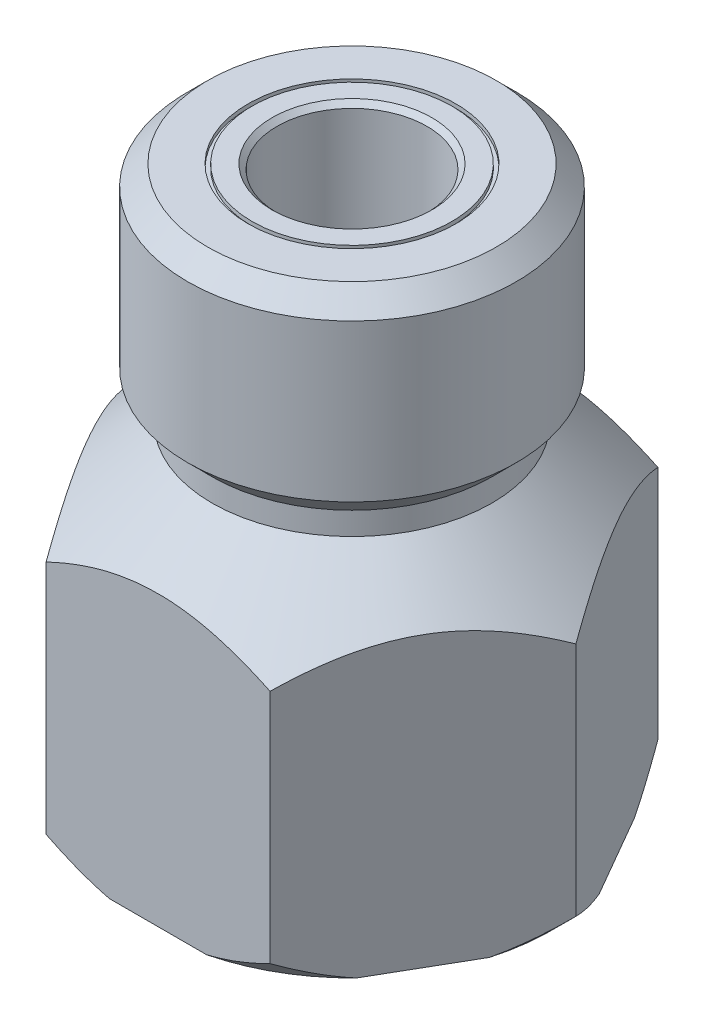
from build123d import *

# Parameters (mm, degrees)
F_3_8_0_375_DIAMETER_HOLE1_D           = 9.525
F_3_8_0_375_DIAMETER_HOLE1_DEPTH       = 13.335
F_3_8_0_375_DIAMETER_HOLE1_CSINK_D     = 10.16
F_3_8_0_375_DIAMETER_HOLE1_CSINK_ANGLE = 90
F_3_8_0_375_DIAMETER_HOLE1_TIP         = 2.861598698
SKETCH4_R                              = 1.27
CUT_EXTRUDE1_DEPTH                     = 29.323277935
CHAMFER1_SIZE                          = 1.524
CUT_EXTRUDE2_DEPTH                     = 42.076598545
CHAMFER2_SIZE                          = 1.27
SKETCH6_R                              = 6.604
SKETCH6_R_2                            = 6.35
CUT_EXTRUDE3_DEPTH                     = 0.254
CHAMFER3_SIZE                          = 0.762


with BuildPart() as part:
    # Sketch1 → Revolve1 (revolve)
    with BuildSketch(Plane.XY, mode=Mode.PRIVATE) as revolve1_sk:
        Polygon((9.525, 0), (14.224, 0), (14.224, 16.51), (8.89, 21.59), (8.89, 23.0378), (10.4394, 24.5872), (10.4394, 35.814), (0, 35.814), (0, 14.097), (1.27, 14.097), (1.27, 15.875), (9.525, 15.875), align=None)
    revolve(revolve1_sk.sketch.rotate(Axis((0, 1.826937735, 0), (0, 1, 0)), 90), axis=Axis((0, 1.826937735, 0), (0, 1, 0)))

    # 3/8 (0.375) Diameter Hole1
    with Locations(Plane(origin=(0, 35.814, 0), x_dir=(1, 0, 0), z_dir=(0, 1, 0))):
        with Locations((0, 0)):
            CounterSinkHole(F_3_8_0_375_DIAMETER_HOLE1_D / 2, F_3_8_0_375_DIAMETER_HOLE1_CSINK_D / 2, depth=F_3_8_0_375_DIAMETER_HOLE1_DEPTH, counter_sink_angle=F_3_8_0_375_DIAMETER_HOLE1_CSINK_ANGLE)
            with Locations((0, 0, -(F_3_8_0_375_DIAMETER_HOLE1_DEPTH + F_3_8_0_375_DIAMETER_HOLE1_TIP / 2))):  # 118° drill point
                Cone(0, F_3_8_0_375_DIAMETER_HOLE1_D / 2, F_3_8_0_375_DIAMETER_HOLE1_TIP, mode=Mode.SUBTRACT)

    # Sketch4 → Cut-Extrude1 (cut, through all)
    with BuildSketch(Plane.XZ.offset(-15.875)):
        with Locations(Location((2.54, 0, 0), (0, 0, 223.987874518))):
            Circle(SKETCH4_R)
    extrude(amount=-CUT_EXTRUDE1_DEPTH, mode=Mode.SUBTRACT)

    # Chamfer1
    chamfer1_edges = [part.edges().sort_by_distance(p)[0] for p in [
        (0, 0, 14.224),
    ]]
    chamfer(chamfer1_edges, length=CHAMFER1_SIZE)

    # Sketch5 → Cut-Extrude2 (cut, through all)
    with BuildSketch(Plane.XZ):
        with BuildLine():
            ThreePointArc((7.112, -12.318345343), (12.318345343, -7.112), (14.224, 0))
            Line((14.224, 0), (7.112, -12.318345343))
        make_face()
        with BuildLine():
            Line((7.112, 12.318345343), (14.224, 0))
            ThreePointArc((14.224, 0), (12.318345343, 7.112), (7.112, 12.318345343))
        make_face()
        with BuildLine():
            Line((-7.112, 12.318345343), (7.112, 12.318345343))
            ThreePointArc((7.112, 12.318345343), (0, 14.224), (-7.112, 12.318345343))
        make_face()
        with BuildLine():
            ThreePointArc((-7.112, -12.318345343), (0, -14.224), (7.112, -12.318345343))
            Line((7.112, -12.318345343), (-7.112, -12.318345343))
        make_face()
        with BuildLine():
            Line((-14.224, 0), (-7.112, 12.318345343))
            ThreePointArc((-7.112, 12.318345343), (-12.318345343, 7.112), (-14.224, 0))
        make_face()
        with BuildLine():
            ThreePointArc((-14.224, 0), (-12.318345343, -7.112), (-7.112, -12.318345343))
            Line((-7.112, -12.318345343), (-14.224, 0))
        make_face()
    extrude(amount=-CUT_EXTRUDE2_DEPTH, mode=Mode.SUBTRACT)

    # Chamfer2
    chamfer2_edges = [part.edges().sort_by_distance(p)[0] for p in [
        (0, 35.814, 10.4394),
    ]]
    chamfer(chamfer2_edges, length=CHAMFER2_SIZE)

    # Sketch6 → Cut-Extrude3 (cut)
    with BuildSketch(Plane(origin=(0, 35.814, 0), x_dir=(1, 0, 0), z_dir=(0, 1, 0))):
        with Locations(Location((0, 0, 0), (0, 0, 270))):
            Circle(SKETCH6_R)
        with Locations(Location((0, 0, 0), (0, 0, 270))):
            Circle(SKETCH6_R_2, mode=Mode.SUBTRACT)
    extrude(amount=-CUT_EXTRUDE3_DEPTH, mode=Mode.SUBTRACT)

    # Chamfer3
    chamfer3_edges = [part.edges().sort_by_distance(p)[0] for p in [
        (0, 0, 9.525),
    ]]
    chamfer(chamfer3_edges, length=CHAMFER3_SIZE)


solid = part.part
